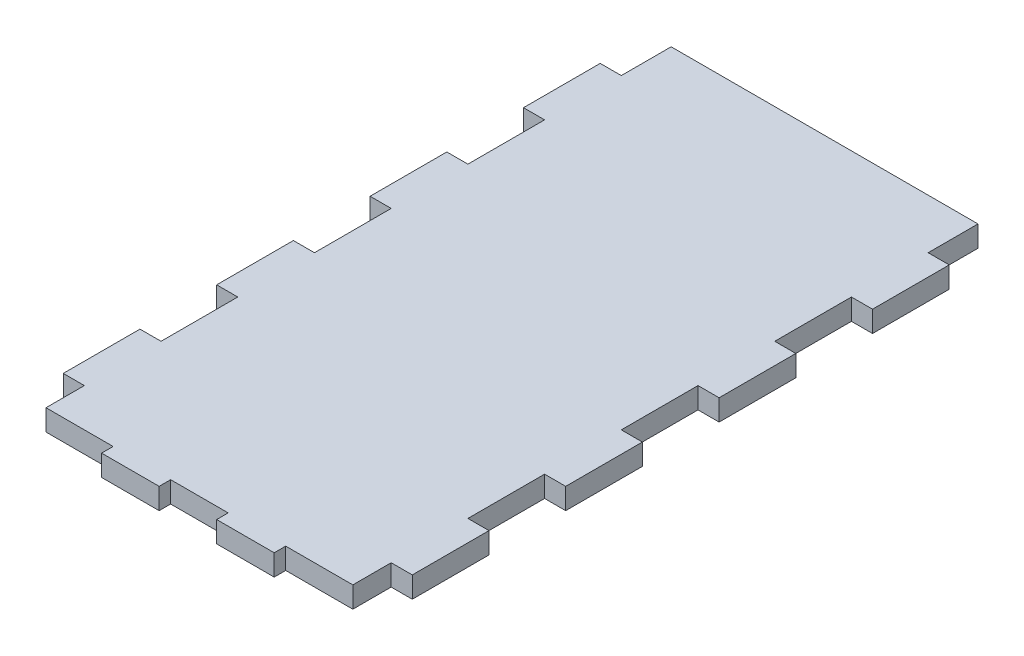
from build123d import *

# Parameters (mm, degrees)
SALIENTE_EXTRUIR1_DEPTH = 5.5


with BuildPart() as part:
    # Croquis1 → Saliente-Extruir1 (new body)
    with BuildSketch(Plane(origin=(0, 0, 0), x_dir=(1, 0, 0), z_dir=(0, 1, 0))):
        Polygon((23, 3), (23, 0), (38, 0), (38, 3), (53, 3), (53, 0), (68, 0), (68, 3), (85.5, 3), (85.5, 13), (91, 13), (91, 33), (85.5, 33), (85.5, 53), (91, 53), (91, 73), (85.5, 73), (85.5, 93), (91, 93), (91, 113), (85.5, 113), (85.5, 133), (91, 133), (91, 153), (85.5, 153), (85.5, 166), (5.5, 166), (5.5, 153), (0, 153), (0, 133), (5.5, 133), (5.5, 113), (0, 113), (0, 93), (5.5, 93), (5.5, 73), (0, 73), (0, 53), (5.5, 53), (5.5, 33), (0, 33), (0, 13), (5.5, 13), (5.5, 3), align=None)
    extrude(amount=SALIENTE_EXTRUIR1_DEPTH)


solid = part.part
